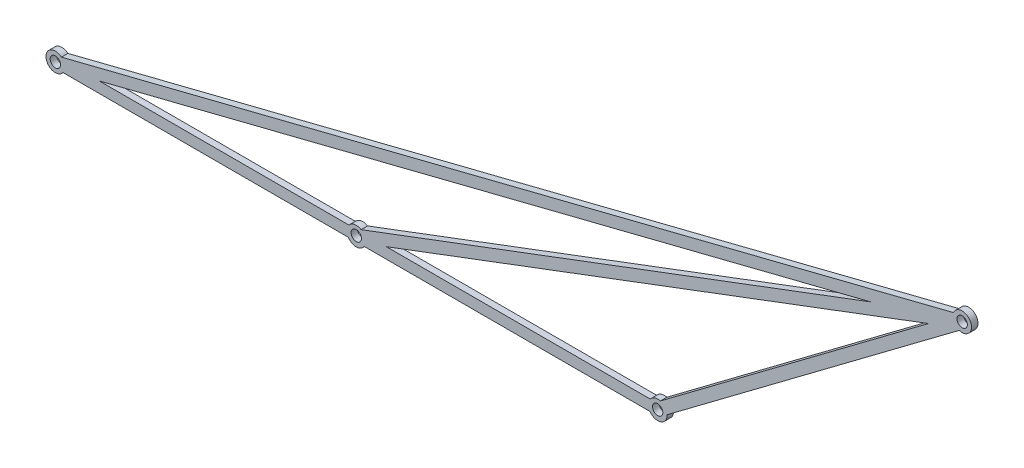
from build123d import *

# Parameters (mm, degrees)
BOSS_EXTRUDE3_DEPTH = 8.5
SKETCH2_R           = 6.815
CUT_EXTRUDE1_DEPTH  = 862.437728783


with BuildPart() as part:
    # Sketch1 → Boss-Extrude3 (new body)
    with BuildSketch(Plane.XY):
        with BuildLine():
            ThreePointArc((395.972037607, 288.042278205), (410.873208436, 304.924541602), (388.360524278, 304.440019711))
            Line((388.360524278, 304.440019711), (-782.647332163, 9.376075193))
            ThreePointArc((-782.647332163, 9.376075193), (-802.796708748, -1.513309192), (-780.597372059, -7.1494))
            Line((-780.597372059, -7.1494), (-406.064833976, -7.1494))
            ThreePointArc((-406.064833976, -7.1494), (-395.672766052, -12.875746118), (-385.280698128, -7.1494))
            Line((-385.280698128, -7.1494), (-10.009831376, -7.1494))
            ThreePointArc((-10.009831376, -7.1494), (4.069984623, -11.891378206), (12.43312578, 0.388094335))
            Line((12.43312578, 0.388094335), (395.972037607, 288.042278205))
        make_face()
        with BuildLine():
            Line((-732.963454166, 7.1494), (280.120400531, 262.420546688))
            Line((280.120400531, 262.420546688), (-389.274490601, 9.913569288))
            ThreePointArc((-389.274490601, 9.913569288), (-397.771252158, 11.52949585), (-405.229196644, 7.1494))
            Line((-405.229196644, 7.1494), (-732.963454166, 7.1494))
        make_face(mode=Mode.SUBTRACT)
        with BuildLine():
            Line((355.529405997, 275.583804497), (3.528425073, 11.583068805))
            ThreePointArc((3.528425073, 11.583068805), (-3.75849008, 11.414643851), (-9.669090245, 7.1494))
            Line((-9.669090245, 7.1494), (-356.08902461, 7.1494))
            Line((-356.08902461, 7.1494), (355.529405997, 275.583804497))
        make_face(mode=Mode.SUBTRACT)
    extrude(amount=BOSS_EXTRUDE3_DEPTH)

    # Sketch2 → Cut-Extrude1 (cut, through all)
    with BuildSketch(Plane.XY.offset(8.5)):
        Circle(SKETCH2_R)
        with Locations((399.723044466, 299.74885191)):
            Circle(SKETCH2_R)
        with Locations((-395.609498981, 0)):
            Circle(SKETCH2_R)
        with Locations((-790.597372059, 0)):
            Circle(SKETCH2_R)
    extrude(amount=-CUT_EXTRUDE1_DEPTH, mode=Mode.SUBTRACT)


solid = part.part
